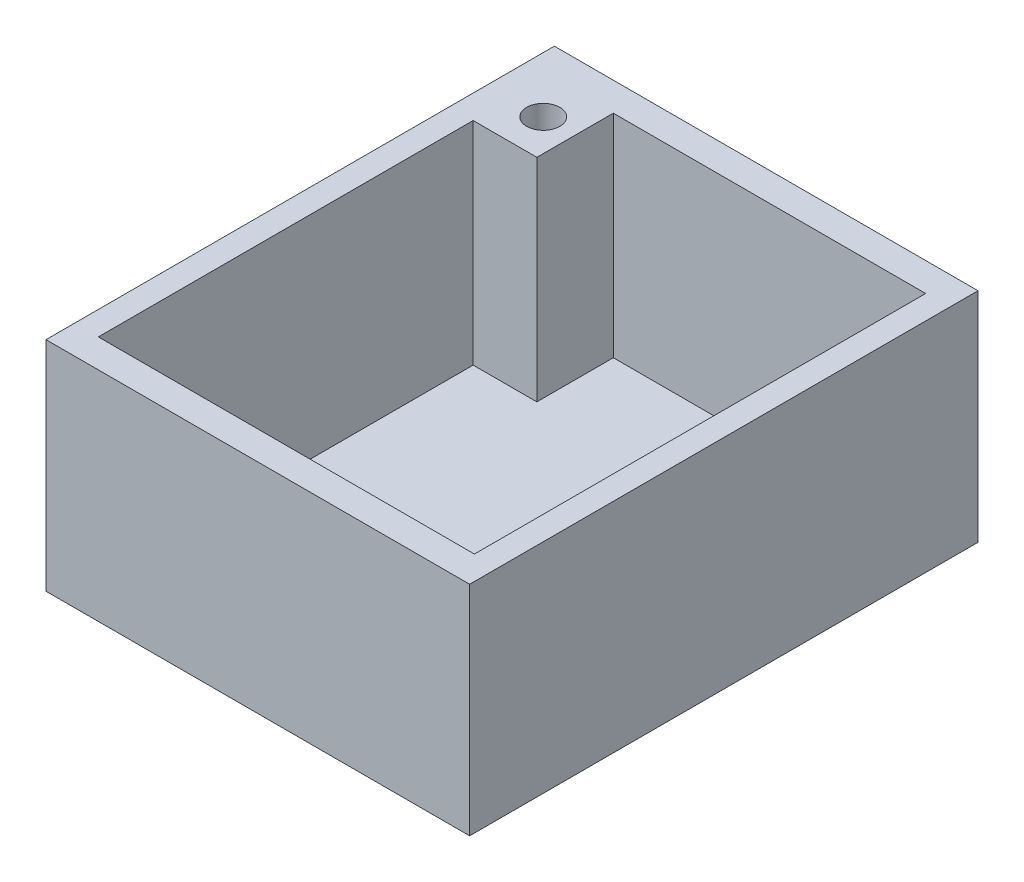
from build123d import *

# Parameters (mm, degrees)
SKETCH_1_W      = 50
SKETCH_1_H      = 60
SKETCH_1_W_2    = 44.384719817
SKETCH_1_H_2    = 53.261663781
SKETCH_1_W_3    = 7.520038949
SKETCH_1_H_3    = 9.02404674
SKETCH_1_R      = 1.953472296
EXTRUDE_1_DEPTH = 25
SKETCH_2_W      = 50
SKETCH_2_H      = 0.716883707
EXTRUDE_2_DEPTH = 60


with BuildPart() as part:
    # Эскиз1 → Бобышка-Вытянуть1 (new body)
    # profile 1 of 2: a face of its own
    with BuildSketch(Plane(origin=(0, 0, 0), x_dir=(1, 0, 0), z_dir=(0, 1, 0))):
        with Locations((25.024105357, 30.007635335)):
            Rectangle(SKETCH_1_W, SKETCH_1_H)
        with Locations((25.024105358, 30.007635335)):
            Rectangle(SKETCH_1_W_2, SKETCH_1_H_2, mode=Mode.SUBTRACT)
    # profile 2 of 2: a face of its own
    with BuildSketch(Plane(origin=(0, 0, 0), x_dir=(1, 0, 0), z_dir=(0, 1, 0))):
        with Locations((6.591764924, 52.126443855)):
            Rectangle(SKETCH_1_W_3, SKETCH_1_H_3)
        with Locations(Location((6.591764924, 52.126443855, 0), (0, 0, 270))):
            Circle(SKETCH_1_R, mode=Mode.SUBTRACT)
    extrude(amount=EXTRUDE_1_DEPTH)

    # Эскиз2 → Бобышка-Вытянуть2 (add)
    with BuildSketch(Plane.XY.offset(-0.007635335)):
        with Locations((25.024105357, -0.358441854)):
            Rectangle(SKETCH_2_W, SKETCH_2_H)
    extrude(amount=-EXTRUDE_2_DEPTH)


solid = part.part
